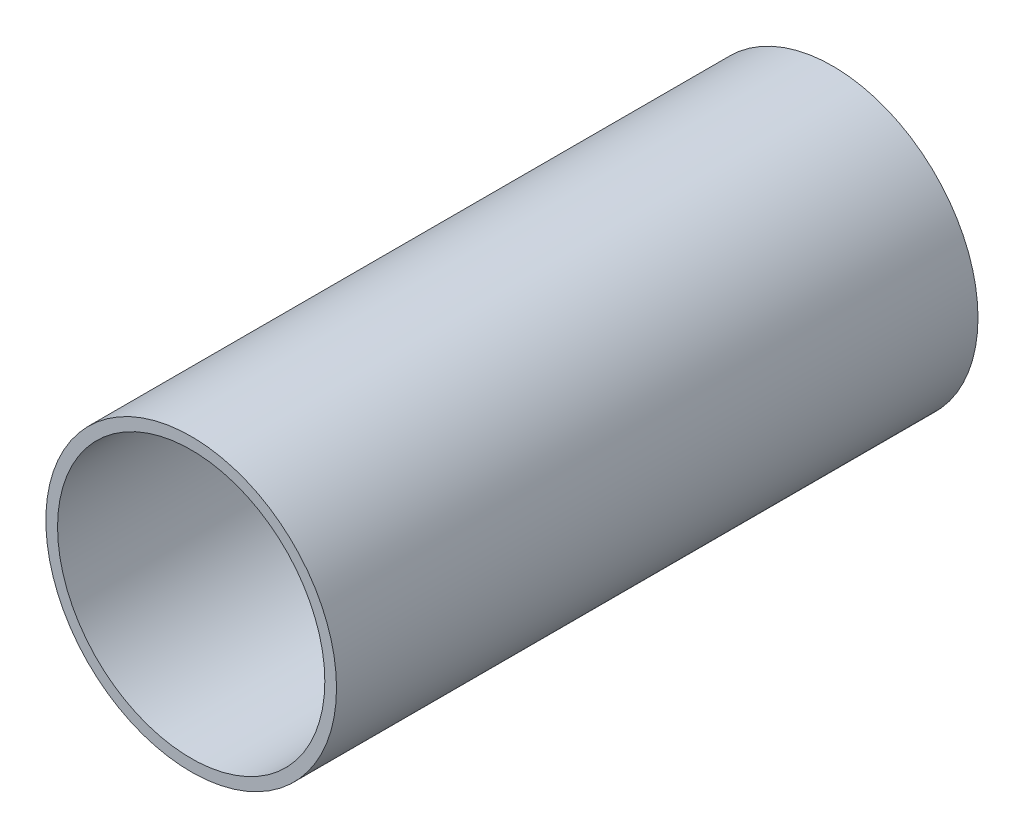
from build123d import *

# Parameters (mm, degrees)
CROQUIS1_R              = 43.5
CROQUIS1_R_2            = 40
SALIENTE_EXTRUIR1_DEPTH = 192


with BuildPart() as part:
    # Croquis1 → Saliente-Extruir1 (new body)
    with BuildSketch(Plane.XY):
        Circle(CROQUIS1_R)
        Circle(CROQUIS1_R_2, mode=Mode.SUBTRACT)
    extrude(amount=SALIENTE_EXTRUIR1_DEPTH)


solid = part.part
